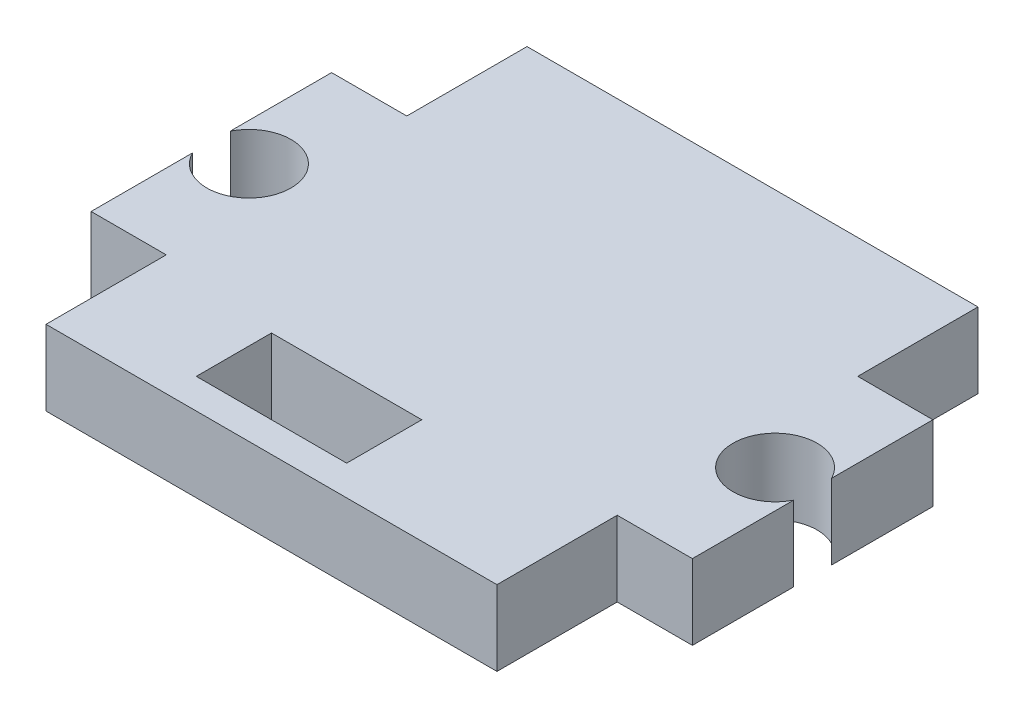
from build123d import *

# Parameters (mm, degrees)
SKETCH1_W           = 25.4
SKETCH1_H           = 20.32
BOSS_EXTRUDE1_DEPTH = 3.175
SKETCH2_W           = 3.175
SKETCH2_H           = 5.08
CUT_EXTRUDE1_DEPTH  = 3.175
SKETCH3_R           = 1.778
CUT_EXTRUDE2_DEPTH  = 3.175
SKETCH4_W           = 6.35
SKETCH4_H           = 3.175
CUT_EXTRUDE3_DEPTH  = 3.175


with BuildPart() as part:
    # Sketch1 → Boss-Extrude1 (new body)
    with BuildSketch(Plane(origin=(0, 0, 0), x_dir=(1, 0, 0), z_dir=(0, 1, 0))):
        with Locations((12.7, -10.16)):
            Rectangle(SKETCH1_W, SKETCH1_H)
    extrude(amount=BOSS_EXTRUDE1_DEPTH)

    # Sketch2 → Cut-Extrude1 (cut)
    with BuildSketch(Plane(origin=(0, 3.175, 0), x_dir=(1, 0, 0), z_dir=(0, 1, 0))):
        with Locations((1.5875, -2.54)):
            Rectangle(SKETCH2_W, SKETCH2_H)
        with Locations((1.5875, -17.78)):
            Rectangle(SKETCH2_W, SKETCH2_H)
        with Locations((23.8125, -2.54)):
            Rectangle(SKETCH2_W, SKETCH2_H)
        with Locations((23.8125, -17.78)):
            Rectangle(SKETCH2_W, SKETCH2_H)
    extrude(amount=-CUT_EXTRUDE1_DEPTH, mode=Mode.SUBTRACT)

    # Sketch3 → Cut-Extrude2 (cut)
    with BuildSketch(Plane(origin=(0, 3.175, 0), x_dir=(1, 0, 0), z_dir=(0, 1, 0))):
        with Locations((1.5875, -10.16)):
            Circle(SKETCH3_R)
        with Locations((23.8125, -10.16)):
            Circle(SKETCH3_R)
    extrude(amount=-CUT_EXTRUDE2_DEPTH, mode=Mode.SUBTRACT)

    # Sketch4 → Cut-Extrude3 (cut)
    with BuildSketch(Plane(origin=(0, 3.175, 0), x_dir=(1, 0, 0), z_dir=(0, 1, 0))):
        with Locations((11.43, -17.4625)):
            Rectangle(SKETCH4_W, SKETCH4_H)
    extrude(amount=-CUT_EXTRUDE3_DEPTH, mode=Mode.SUBTRACT)


solid = part.part
